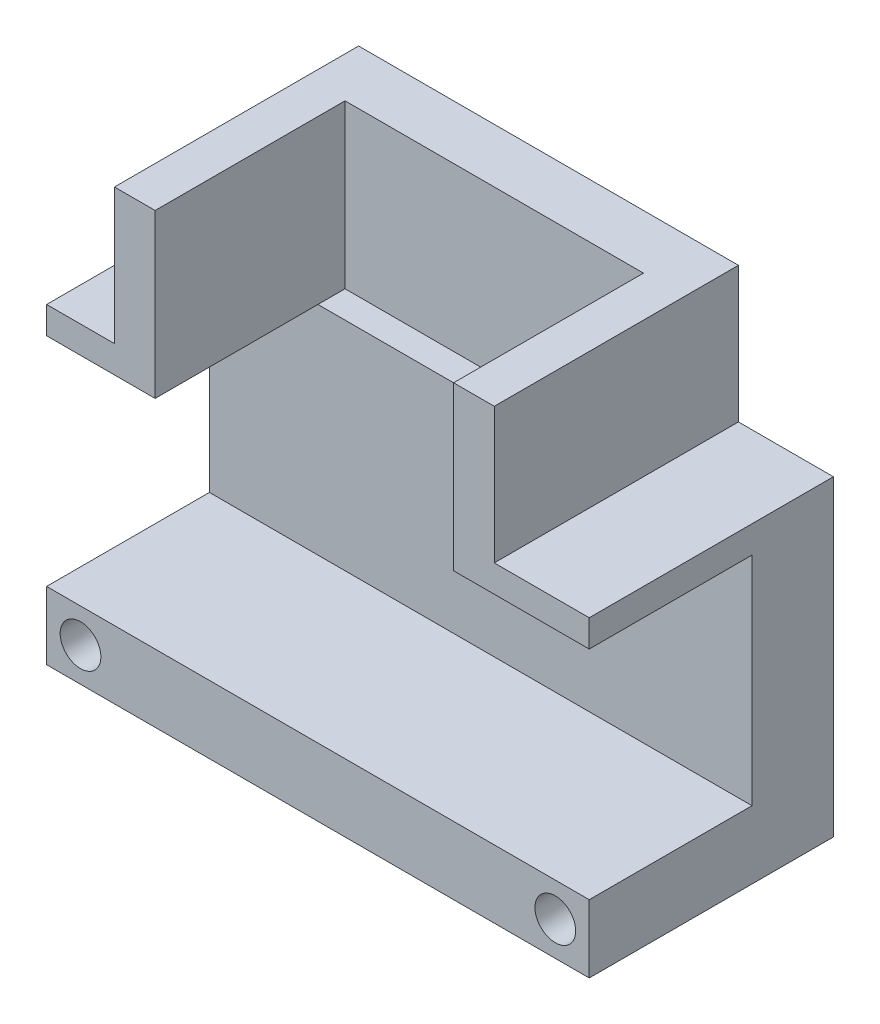
from build123d import *

# Parameters (mm, degrees)
SALIENTE_EXTRUIR1_DEPTH = 18
CORTAR_EXTRUIR1_DEPTH   = 14
CROQUIS3_W              = 40
CROQUIS3_H              = 16
SALIENTE_EXTRUIR2_DEPTH = 2
CROQUIS10_R             = 1.5
CORTAR_EXTRUIR2_DEPTH   = 10


with BuildPart() as part:
    # Croquis1 → Saliente-Extruir1 (new body)
    with BuildSketch(Plane.XY):
        Polygon((-49.27736704, 8.428571429), (-49.27736704, -14.571428571), (-9.27736704, -14.571428571), (-9.27736704, 8.428571429), (-16.27736704, 8.428571429), (-16.27736704, 18.428571429), (-44.27736704, 18.428571429), (-44.27736704, 8.428571429), align=None)
    extrude(amount=SALIENTE_EXTRUIR1_DEPTH)

    # Croquis2 → Cortar-Extruir1 (cut)
    with BuildSketch(Plane.XY.offset(18)):
        Polygon((-9.27736704, 6.428571429), (-9.27736704, -9.571428571), (-49.27736704, -9.571428571), (-49.27736704, 6.428571429), (-41.27736704, 6.428571429), (-41.27736704, 18.428571429), (-19.27736704, 18.428571429), (-19.27736704, 6.428571429), align=None)
    extrude(amount=-CORTAR_EXTRUIR1_DEPTH, mode=Mode.SUBTRACT)

    # Croquis3 → Saliente-Extruir2 (add)
    with BuildSketch(Plane.XY.offset(4)):
        with Locations((-29.27736704, -1.571428571)):
            Rectangle(CROQUIS3_W, CROQUIS3_H)
    extrude(amount=SALIENTE_EXTRUIR2_DEPTH)

    # Croquis10 → Cortar-Extruir2 (cut)
    with BuildSketch(Plane.XY.offset(18)):
        with Locations((-46.77736704, -12.071428571)):
            Circle(CROQUIS10_R)
        with Locations((-11.77736704, -12.071428571)):
            Circle(CROQUIS10_R)
    extrude(amount=-CORTAR_EXTRUIR2_DEPTH, mode=Mode.SUBTRACT)


solid = part.part
